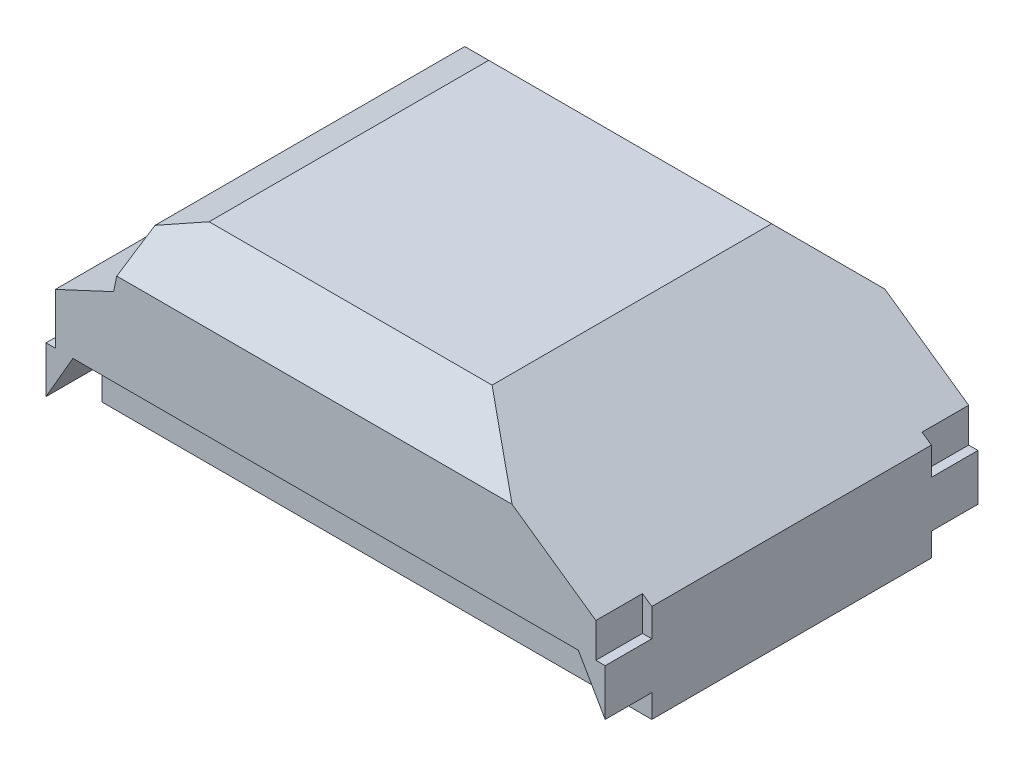
from build123d import *

# Parameters (mm, degrees)
BOSS_EXTRUDE1_DEPTH             = 38.1
CUT_EXTRUDE1_DEPTH              = 100.190170884
CUT_EXTRUDE1_DEPTH_BACK         = 100.190170884
BOSS_EXTRUDE2_REACH             = 101.19
BOSS_EXTRUDE2_DIRECTION_2_REACH = 101.19
CUT_EXTRUDE2_DEPTH              = 100.190170884
CUT_EXTRUDE2_DEPTH_BACK         = 100.190170884
SKETCH5_W                       = 149.86
SKETCH5_H                       = 76.2
BOSS_EXTRUDE4_DEPTH             = 19.05


with BuildPart() as part:
    # Sketch1 → Boss-Extrude1 (new body)
    with BuildSketch(Plane(origin=(44.224720049, 74.891650501, 130.282900288), x_dir=(1, 0, 0), z_dir=(0, 1, 0))):
        Polygon((-73.66, -50.8), (-73.66, -19.05), (-76.2, -19.05), (-76.2, 19.05), (-73.66, 19.05), (-73.66, 50.8), (73.66, 50.8), (73.66, 38.1), (76.2, 38.1), (76.2, -38.1), (73.66, -38.1), (73.66, -50.8), align=None)
    extrude(amount=BOSS_EXTRUDE1_DEPTH)

    # Sketch2 → Cut-Extrude1 (cut, two sides: drawn at the far end of the back side and taken through both)
    with BuildSketch(Plane(origin=(44.224720049, 74.891650501, 130.282900288), x_dir=(1, 0, 0), z_dir=(0, 0, 1)).offset(-CUT_EXTRUDE1_DEPTH_BACK)):
        Polygon((-76.2, 12.7), (-57.783825767, 21.287603079), (-55.084357434, 33.987603079), (-44.45, 38.1), (-76.2, 38.1), align=None)
        Polygon((32.670048754, 38.1), (76.2, 7.62), (76.2, 38.1), align=None)
    extrude(amount=CUT_EXTRUDE1_DEPTH + CUT_EXTRUDE1_DEPTH_BACK, mode=Mode.SUBTRACT)

    # Boss-Extrude2: up to this face of the body (flat: up to its plane)
    boss_extrude2_end = Plane(part.part.faces().sort_by_distance((41.857775963, 91.970339861, 181.082900288))[0])
    # Sketch3 → Boss-Extrude2 (add, up to the picked face)
    with BuildSketch(Plane(origin=(44.224720049, 74.891650501, 130.282900288), x_dir=(1, 0, 0), z_dir=(0, 0, 1)), mode=Mode.PRIVATE) as boss_extrude2_sk1:
        Polygon((-76.2, 0), (-76.2, -12.7), (-68.867651581, 0), align=None)
    boss_extrude2_tool1 = split(extrude(boss_extrude2_sk1.sketch, amount=BOSS_EXTRUDE2_REACH, mode=Mode.PRIVATE), bisect_by=boss_extrude2_end, keep=Keep.BOTH, mode=Mode.PRIVATE)
    # Sketch3 → Boss-Extrude2 (add, up to the picked face)
    with BuildSketch(Plane(origin=(44.224720049, 74.891650501, 130.282900288), x_dir=(1, 0, 0), z_dir=(0, 0, 1)), mode=Mode.PRIVATE) as boss_extrude2_sk2:
        Polygon((76.2, 0), (76.2, -12.7), (68.867651581, 0), align=None)
    boss_extrude2_tool2 = split(extrude(boss_extrude2_sk2.sketch, amount=BOSS_EXTRUDE2_REACH, mode=Mode.PRIVATE), bisect_by=boss_extrude2_end, keep=Keep.BOTH, mode=Mode.PRIVATE)
    add(boss_extrude2_tool1.solids().sort_by(Axis((-29.531164, 70.658317, 130.2829), (0, 0, 1)))[0])
    add(boss_extrude2_tool2.solids().sort_by(Axis((117.980604, 70.658317, 130.2829), (0, 0, 1)))[0])

    # Boss-Extrude2 direction 2: up to this face of the body (flat: up to its plane)
    boss_extrude2_direction_2_end = Plane(part.part.faces().sort_by_distance((41.857775963, 91.970339861, 79.482900288))[0])
    # Sketch3 → Boss-Extrude2 direction 2 (add, up to the picked face)
    with BuildSketch(Plane(origin=(44.224720049, 74.891650501, 130.282900288), x_dir=(1, 0, 0), z_dir=(0, 0, 1)), mode=Mode.PRIVATE) as boss_extrude2_direction_2_sk1:
        Polygon((-76.2, 0), (-76.2, -12.7), (-68.867651581, 0), align=None)
    boss_extrude2_direction_2_tool1 = split(extrude(boss_extrude2_direction_2_sk1.sketch, amount=-BOSS_EXTRUDE2_DIRECTION_2_REACH, mode=Mode.PRIVATE), bisect_by=boss_extrude2_direction_2_end, keep=Keep.BOTH, mode=Mode.PRIVATE)
    # Sketch3 → Boss-Extrude2 direction 2 (add, up to the picked face)
    with BuildSketch(Plane(origin=(44.224720049, 74.891650501, 130.282900288), x_dir=(1, 0, 0), z_dir=(0, 0, 1)), mode=Mode.PRIVATE) as boss_extrude2_direction_2_sk2:
        Polygon((76.2, 0), (76.2, -12.7), (68.867651581, 0), align=None)
    boss_extrude2_direction_2_tool2 = split(extrude(boss_extrude2_direction_2_sk2.sketch, amount=-BOSS_EXTRUDE2_DIRECTION_2_REACH, mode=Mode.PRIVATE), bisect_by=boss_extrude2_direction_2_end, keep=Keep.BOTH, mode=Mode.PRIVATE)
    add(boss_extrude2_direction_2_tool1.solids().sort_by(Axis((-29.531164, 70.658317, 130.2829), (0, 0, -1)))[0])
    add(boss_extrude2_direction_2_tool2.solids().sort_by(Axis((117.980604, 70.658317, 130.2829), (0, 0, -1)))[0])

    # Sketch4 → Cut-Extrude2 (cut, two sides: drawn at the far end of the back side and taken through both)
    with BuildSketch(Plane(origin=(44.224720049, 74.891650501, 130.282900288), x_dir=(0, 0, -1), z_dir=(1, 0, 0)).offset(-CUT_EXTRUDE2_DEPTH_BACK)):
        Polygon((-38.1, 38.1), (-50.8, 25.4), (-50.8, 38.1), align=None)
        Polygon((38.1, 38.1), (50.8, 25.4), (50.8, 38.1), align=None)
    extrude(amount=CUT_EXTRUDE2_DEPTH + CUT_EXTRUDE2_DEPTH_BACK, mode=Mode.SUBTRACT)

    # Sketch5 → Boss-Extrude4 (add)
    with BuildSketch(Plane.XZ.offset(-74.891650501)):
        with Locations((45.494720049, 130.282900288)):
            Rectangle(SKETCH5_W, SKETCH5_H)
    extrude(amount=BOSS_EXTRUDE4_DEPTH)


solid = part.part
